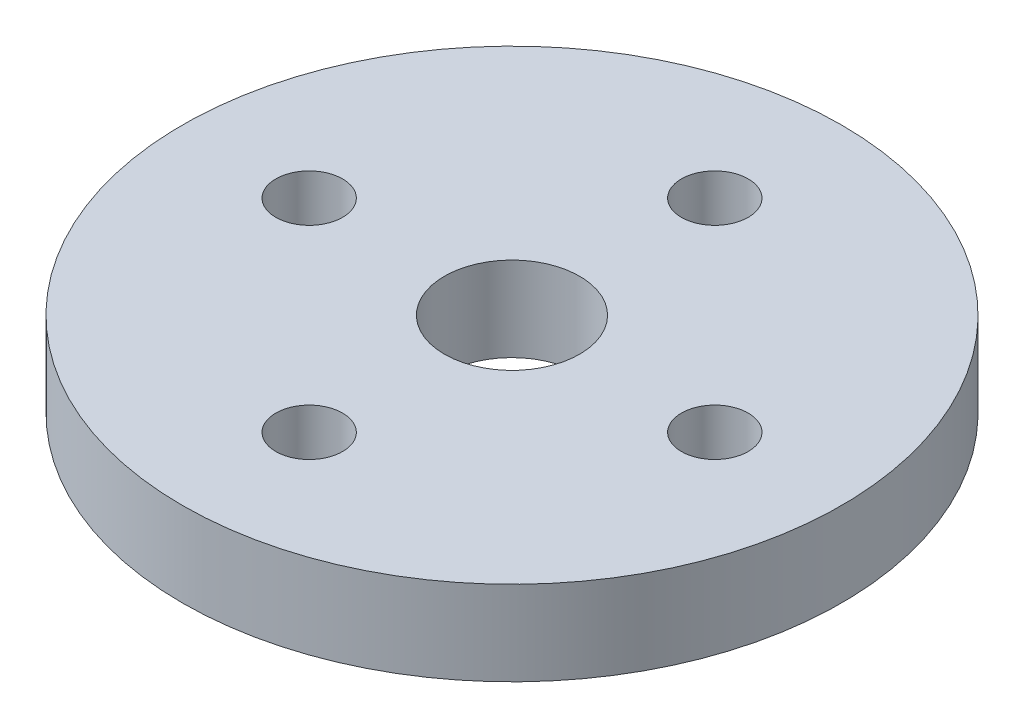
from build123d import *

# Parameters (mm, degrees)
SKETCH1_R           = 19.5
SKETCH1_R_2         = 4
SKETCH1_R_3         = 1.975
BOSS_EXTRUDE1_DEPTH = 5


with BuildPart() as part:
    # Sketch1 → Boss-Extrude1 (new body)
    with BuildSketch(Plane(origin=(0, 0, 0), x_dir=(1, 0, 0), z_dir=(0, 1, 0))):
        with Locations(Location((0, 0, 0), (0, 0, 270))):
            Circle(SKETCH1_R)
        with Locations(Location((0, 0, 0), (0, 0, 270))):
            Circle(SKETCH1_R_2, mode=Mode.SUBTRACT)
        with Locations(Location((0, 12, 0), (0, 0, 270))):
            Circle(SKETCH1_R_3, mode=Mode.SUBTRACT)
        with Locations(Location((12, 0, 0), (0, 0, 270))):
            Circle(SKETCH1_R_3, mode=Mode.SUBTRACT)
        with Locations(Location((0, -12, 0), (0, 0, 270))):
            Circle(SKETCH1_R_3, mode=Mode.SUBTRACT)
        with Locations(Location((-12, 0, 0), (0, 0, 270))):
            Circle(SKETCH1_R_3, mode=Mode.SUBTRACT)
    extrude(amount=BOSS_EXTRUDE1_DEPTH)


solid = part.part
